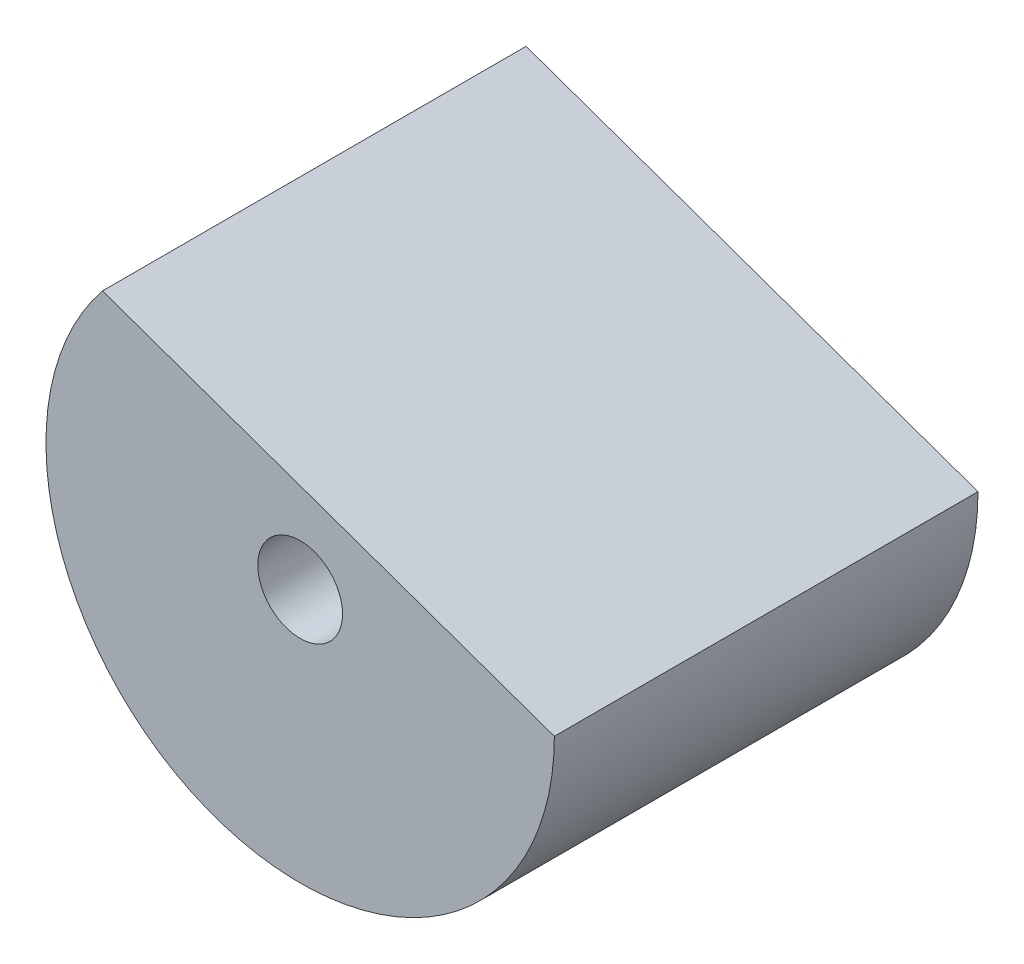
from build123d import *

# Parameters (mm, degrees)
SCHIZZO1_R                   = 0.5
ESTRUSIONE_ESTRUSIONE1_DEPTH = 5


with BuildPart() as part:
    # Schizzo1 → Estrusione-Estrusione1 (new body)
    with BuildSketch(Plane.XY):
        with BuildLine():
            Line((3, 0), (-2.333333333, 1.885618083))
            ThreePointArc((-2.333333333, 1.885618083), (-1, -2.828427125), (3, 0))
        make_face()
        Circle(SCHIZZO1_R, mode=Mode.SUBTRACT)
    extrude(amount=ESTRUSIONE_ESTRUSIONE1_DEPTH)


solid = part.part
